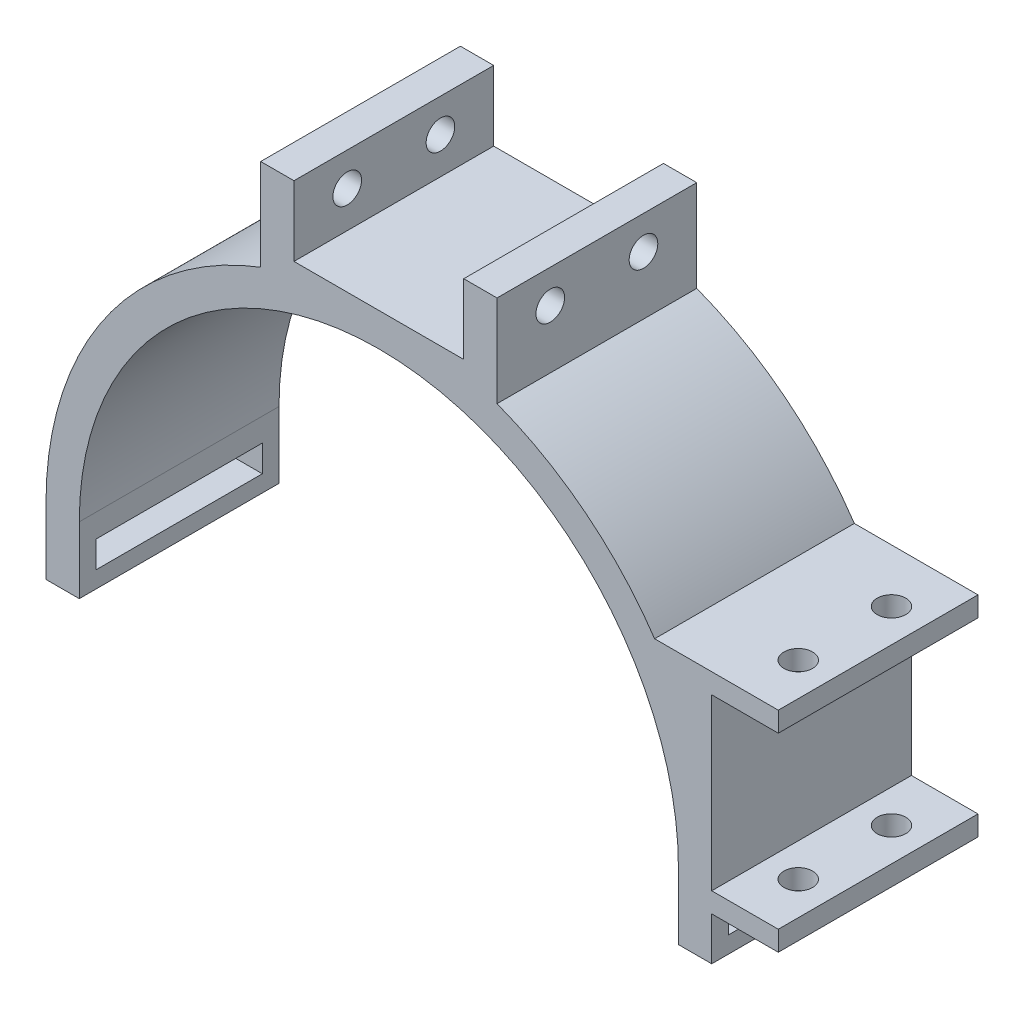
from build123d import *

# Parameters (mm, degrees)
SKETCH1_W                = 5
SKETCH1_H                = 10
BOSS_EXTRUDE1_DEPTH      = 30
BOSS_EXTRUDE2_START      = -30
BOSS_EXTRUDE2_DEPTH      = 30
SKETCH3_W                = 25
SKETCH3_H                = 4
CUT_EXTRUDE1_DEPTH       = 121.665860955
BOSS_EXTRUDE3_REACH      = 122.666
BOSS_EXTRUDE3_END_RADIUS = 50
SKETCH4_W                = 30
SKETCH4_H                = 31.5
SKETCH5_W                = 30
SKETCH5_H                = 3
BOSS_EXTRUDE4_DEPTH      = 10
SKETCH6_R                = 2.15
CUT_EXTRUDE2_DEPTH       = 103.982097959
SKETCH7_R                = 2.15
CUT_EXTRUDE3_DEPTH       = 116.62439189


with BuildPart() as part:
    # Sketch1 → Boss-Extrude1 (new body)
    with BuildSketch(Plane.XY):
        with BuildLine():
            ThreePointArc((-5, 0), (45, 50), (95, 0))
            Line((95, 0), (90, 0))
            ThreePointArc((90, 0), (45, 45), (0, 0))
            Line((0, 0), (-5, 0))
        make_face()
        with Locations((92.5, -5)):
            Rectangle(SKETCH1_W, SKETCH1_H)
        with Locations((-2.5, -5)):
            Rectangle(SKETCH1_W, SKETCH1_H)
    extrude(amount=BOSS_EXTRUDE1_DEPTH)

    # Sketch2 → Boss-Extrude2 (add)
    with BuildSketch(Plane.XY.offset(30).offset(BOSS_EXTRUDE2_START)):
        with BuildLine():
            Line((32.25, 48.347052651), (32.25, 50))
            Line((32.25, 50), (32.25, 60.5))
            Line((32.25, 60.5), (27.25, 60.5))
            Line((27.25, 60.5), (27.25, 46.74331503))
            ThreePointArc((27.25, 46.74331503), (29.728932795, 47.610865424), (32.25, 48.347052651))
        make_face()
        with BuildLine():
            ThreePointArc((32.25, 48.347052651), (38.571649999, 49.585041255), (45, 50))
            Line((45, 50), (32.25, 50))
            Line((32.25, 50), (32.25, 48.347052651))
        make_face()
        with BuildLine():
            Line((32.25, 45), (45, 45))
            Line((45, 45), (45, 50))
            ThreePointArc((45, 50), (38.571649999, 49.585041255), (32.25, 48.347052651))
            Line((32.25, 48.347052651), (32.25, 45))
        make_face()
        with BuildLine():
            Line((45, 45), (57.75, 45))
            Line((57.75, 45), (57.75, 48.347052651))
            ThreePointArc((57.75, 48.347052651), (51.428350001, 49.585041255), (45, 50))
            Line((45, 50), (45, 45))
        make_face()
        with BuildLine():
            ThreePointArc((45, 50), (51.428350001, 49.585041255), (57.75, 48.347052651))
            Line((57.75, 48.347052651), (57.75, 50))
            Line((57.75, 50), (45, 50))
        make_face()
        with BuildLine():
            Line((57.75, 50), (57.75, 48.347052651))
            ThreePointArc((57.75, 48.347052651), (60.271067205, 47.610865424), (62.75, 46.74331503))
            Line((62.75, 46.74331503), (62.75, 60.5))
            Line((62.75, 60.5), (57.75, 60.5))
            Line((57.75, 60.5), (57.75, 50))
        make_face()
        with BuildLine():
            Line((27.25, 45), (32.25, 45))
            Line((32.25, 45), (32.25, 48.347052651))
            ThreePointArc((32.25, 48.347052651), (29.728932795, 47.610865424), (27.25, 46.74331503))
            Line((27.25, 46.74331503), (27.25, 45))
        make_face()
        with BuildLine():
            Line((57.75, 48.347052651), (57.75, 45))
            Line((57.75, 45), (62.75, 45))
            Line((62.75, 45), (62.75, 46.74331503))
            ThreePointArc((62.75, 46.74331503), (60.271067205, 47.610865424), (57.75, 48.347052651))
        make_face()
    extrude(amount=BOSS_EXTRUDE2_DEPTH)

    # Sketch3 → Cut-Extrude1 (cut, through all)
    with BuildSketch(Plane(origin=(95, 0, 0), x_dir=(0, 0, -1), z_dir=(1, 0, 0))):
        with Locations((-15, -5.5)):
            Rectangle(SKETCH3_W, SKETCH3_H)
    extrude(amount=-CUT_EXTRUDE1_DEPTH, mode=Mode.SUBTRACT)

    # Boss-Extrude3: up to this cylinder (the profile starts outside it)
    boss_extrude3_end = Plane(origin=(45, 0, 15), z_dir=(0, 0, -1)) * Cylinder(BOSS_EXTRUDE3_END_RADIUS, 346.332, mode=Mode.PRIVATE)
    # Sketch4 → Boss-Extrude3 (add, up to the surface)
    with BuildSketch(Plane(origin=(95, 0, 0), x_dir=(0, 0, -1), z_dir=(1, 0, 0)), mode=Mode.PRIVATE) as boss_extrude3_sk1:
        with Locations((-15, 12.25)):
            Rectangle(SKETCH4_W, SKETCH4_H)
    boss_extrude3_tool1 = extrude(boss_extrude3_sk1.sketch, amount=-BOSS_EXTRUDE3_REACH, mode=Mode.PRIVATE) - boss_extrude3_end
    add(boss_extrude3_tool1.solids().sort_by_distance((95, 12.25, 15))[0])
    add(boss_extrude3_tool1.solids().sort_by_distance((95, 12.25, 15))[1])

    # Sketch5 → Boss-Extrude4 (add)
    with BuildSketch(Plane(origin=(95, 0, 0), x_dir=(0, 0, -1), z_dir=(1, 0, 0))):
        with Locations((-15, -2)):
            Rectangle(SKETCH5_W, SKETCH5_H)
        with Locations((-15, 26.5)):
            Rectangle(SKETCH5_W, SKETCH5_H)
    extrude(amount=BOSS_EXTRUDE4_DEPTH)

    # Sketch6 → Cut-Extrude2 (cut, through all)
    with BuildSketch(Plane.ZY.offset(-27.25)):
        with Locations(Location((22, 55.5, 0), (0, 0, 180))):
            Circle(SKETCH6_R)
        with Locations(Location((8, 55.5, 0), (0, 0, 180))):
            Circle(SKETCH6_R)
    extrude(amount=-CUT_EXTRUDE2_DEPTH, mode=Mode.SUBTRACT)

    # Sketch7 → Cut-Extrude3 (cut, through all)
    with BuildSketch(Plane(origin=(0, 28, 0), x_dir=(1, 0, 0), z_dir=(0, 1, 0))):
        with Locations(Location((100, -22, 0), (0, 0, 180))):
            Circle(SKETCH7_R)
        with Locations(Location((100, -8, 0), (0, 0, 180))):
            Circle(SKETCH7_R)
    extrude(amount=-CUT_EXTRUDE3_DEPTH, mode=Mode.SUBTRACT)


solid = part.part
